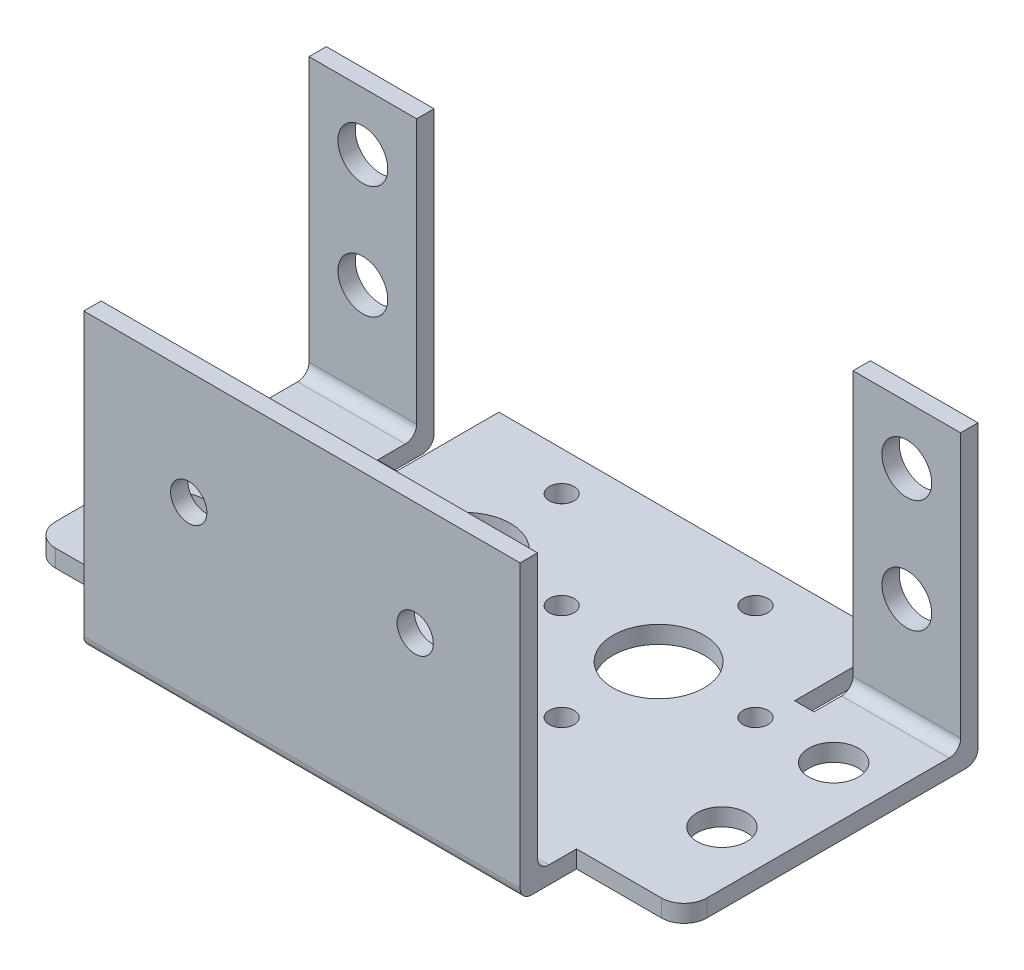
from build123d import *

# Parameters (mm, degrees)
SKETCH1_W               = 57.15
SKETCH1_H               = 34.72
BOSS_EXTRUDE1_DEPTH     = 1.524
SKETCH2_W               = 9.44
SKETCH2_H               = 4.95
CUT_EXTRUDE1_DEPTH      = 5
SKETCH3_R               = 2.1844
CUT_EXTRUDE2_DEPTH      = 5
SKETCH4_W               = 38.27
SKETCH4_H               = 1.524
SKETCH4_W_2             = 9.44
BOSS_EXTRUDE2_DEPTH     = 24.2
SKETCH5_R               = 1.59
CUT_EXTRUDE3_DEPTH      = 12.1
SKETCH6_R               = 1.09
CUT_EXTRUDE4_DEPTH      = 24.2
SKETCH7_R               = 4
CUT_EXTRUDE5_DEPTH      = 24.2
SKETCH8_R               = 1.09
CUT_EXTRUDE6_DEPTH      = 24.2
CIRPATTERN1_COUNT       = 4
MIRROR3_COPY_1_SKETCH_R = 1.09
MIRROR3_COPY_1_DEPTH    = 24.2
MIRROR3_COPY_2_SKETCH_R = 1.09
MIRROR3_COPY_2_DEPTH    = 24.2
SKETCH9_R               = 2.1844
CUT_EXTRUDE7_DEPTH      = 12.1
FILLET1_R               = 2
FILLET2_R               = 1


with BuildPart() as part:
    # Sketch1 → Boss-Extrude1 (new body)
    with BuildSketch(Plane(origin=(0, 0, 0), x_dir=(1, 0, 0), z_dir=(0, 1, 0))):
        Rectangle(SKETCH1_W, SKETCH1_H)
    extrude(amount=BOSS_EXTRUDE1_DEPTH)

    # Sketch2 → Cut-Extrude1 (cut, symmetric)
    with BuildSketch(Plane(origin=(0, 1.524, 0), x_dir=(1, 0, 0), z_dir=(0, 1, 0))):
        with Locations((23.855, -14.885)):
            Rectangle(SKETCH2_W, SKETCH2_H)
        Polygon((28.575, 17.36), (17.445, 17.36), (17.445, 8.41), (19.135, 8.41), (19.135, 13.36), (28.575, 13.36), align=None)
    cut_extrude1 = extrude(amount=CUT_EXTRUDE1_DEPTH, both=True, mode=Mode.SUBTRACT)

    # Mirror1: Cut-Extrude1 across plane
    add(cut_extrude1.mirror(Plane(origin=(0, 0, 0), x_dir=(0, 0, 1), z_dir=(1, 0, 0))), mode=Mode.SUBTRACT)

    # Sketch3 → Cut-Extrude2 (cut, symmetric)
    with BuildSketch(Plane(origin=(0, 1.524, 0), x_dir=(1, 0, 0), z_dir=(0, 1, 0))):
        with Locations(Location((23.855, -4.38, 0), (0, 0, 90))):
            Circle(SKETCH3_R)
        with Locations(Location((23.855, 5.42, 0), (0, 0, 90))):
            Circle(SKETCH3_R)
    cut_extrude2 = extrude(amount=CUT_EXTRUDE2_DEPTH, both=True, mode=Mode.SUBTRACT)

    # Mirror2: Cut-Extrude2 across plane
    add(cut_extrude2.mirror(Plane(origin=(0, 0, 0), x_dir=(0, 0, 1), z_dir=(1, 0, 0))), mode=Mode.SUBTRACT)

    # Sketch4 → Boss-Extrude2 (add)
    with BuildSketch(Plane(origin=(0, 1.524, 0), x_dir=(1, 0, 0), z_dir=(0, 1, 0))):
        with Locations((0, -16.598)):
            Rectangle(SKETCH4_W, SKETCH4_H)
        with Locations((-23.855, 12.598)):
            Rectangle(SKETCH4_W_2, SKETCH4_H)
        with Locations((23.855, 12.598)):
            Rectangle(SKETCH4_W_2, SKETCH4_H)
    extrude(amount=BOSS_EXTRUDE2_DEPTH)

    # Sketch5 → Cut-Extrude3 (cut, symmetric)
    with BuildSketch(Plane.XY.offset(17.36)):
        with Locations((-9.93, 15.794)):
            Circle(SKETCH5_R)
        with Locations((9.93, 15.794)):
            Circle(SKETCH5_R)
    extrude(amount=CUT_EXTRUDE3_DEPTH, both=True, mode=Mode.SUBTRACT)

    # Sketch6 → Cut-Extrude4 (cut)
    with BuildSketch(Plane(origin=(0, 1.524, 0), x_dir=(1, 0, 0), z_dir=(0, 1, 0))):
        with Locations(Location((0, 5.42, 0), (0, 0, 270))):
            Circle(SKETCH6_R)
    extrude(amount=-CUT_EXTRUDE4_DEPTH, mode=Mode.SUBTRACT)

    # Sketch7 → Cut-Extrude5 (cut)
    with BuildSketch(Plane(origin=(0, 1.524, 0), x_dir=(1, 0, 0), z_dir=(0, 1, 0))):
        with Locations(Location((-8.5, 5.42, 0), (0, 0, 270))):
            Circle(SKETCH7_R)
    cut_extrude5 = extrude(amount=-CUT_EXTRUDE5_DEPTH, mode=Mode.SUBTRACT)

    # Sketch8 → Cut-Extrude6 (cut)
    with BuildSketch(Plane(origin=(0, 1.524, 0), x_dir=(1, 0, 0), z_dir=(0, 1, 0))):
        with Locations(Location((-8.5, 13.92, 0), (0, 0, 270))):
            Circle(SKETCH8_R)
    cut_extrude6 = extrude(amount=-CUT_EXTRUDE6_DEPTH, mode=Mode.SUBTRACT)

    # CirPattern1: Cut-Extrude6 ×4 about axis, 1 skipped
    cirpattern1_axis = Axis((-8.5, 0, -5.42), (0, 1, 0))
    add([cut_extrude6.rotate(cirpattern1_axis, i * 360 / CIRPATTERN1_COUNT) for i in range(1, CIRPATTERN1_COUNT) if i not in (3,)], mode=Mode.SUBTRACT)

    # Mirror3: Cut-Extrude5, Cut-Extrude6 across plane
    add(cut_extrude5.mirror(Plane(origin=(0, 0, 0), x_dir=(0, 0, 1), z_dir=(1, 0, 0))), mode=Mode.SUBTRACT)
    add(cut_extrude6.mirror(Plane(origin=(0, 0, 0), x_dir=(0, 0, 1), z_dir=(1, 0, 0))), mode=Mode.SUBTRACT)

    # Mirror3 copy 1 sketch → Mirror3 copy 1 (cut)
    with BuildSketch(Plane(origin=(3.08, 1.524, -13.92), x_dir=(0, 0, -1), z_dir=(0, 1, 0))):
        with Locations((-8.5, -13.92)):
            Circle(MIRROR3_COPY_1_SKETCH_R)
    extrude(amount=-MIRROR3_COPY_1_DEPTH, mode=Mode.SUBTRACT)

    # Mirror3 copy 2 sketch → Mirror3 copy 2 (cut)
    with BuildSketch(Plane(origin=(17, 1.524, -10.84), x_dir=(1, 0, 0), z_dir=(0, 1, 0))):
        with Locations((-8.5, -13.92)):
            Circle(MIRROR3_COPY_2_SKETCH_R)
    extrude(amount=-MIRROR3_COPY_2_DEPTH, mode=Mode.SUBTRACT)

    # Sketch9 → Cut-Extrude7 (cut, symmetric)
    with BuildSketch(Plane.XY.offset(-11.836)):
        with Locations(Location((-23.855, 20.644, 0), (0, 0, 180))):
            Circle(SKETCH9_R)
        with Locations(Location((-23.855, 10.734, 0), (0, 0, 180))):
            Circle(SKETCH9_R)
        with Locations((23.855, 10.734)):
            Circle(SKETCH9_R)
        with Locations((23.855, 20.644)):
            Circle(SKETCH9_R)
    extrude(amount=CUT_EXTRUDE7_DEPTH, both=True, mode=Mode.SUBTRACT)

    # Fillet1
    fillet1_edges = [part.edges().sort_by_distance(p)[0] for p in [
        (28.575, 0.762, 12.41),
        (-28.575, 0.762, 12.41),
    ]]
    fillet(fillet1_edges, radius=FILLET1_R)

    # Fillet2
    fillet2_edges = [part.edges().sort_by_distance(p)[0] for p in [
        (0, 0, 17.36),
        (23.855, 0, -13.36),
        (-23.855, 0, -13.36),
        (0, 1.524, 15.836),
        (23.855, 1.524, -11.836),
        (-23.855, 1.524, -11.836),
    ]]
    fillet(fillet2_edges, radius=FILLET2_R)


solid = part.part
